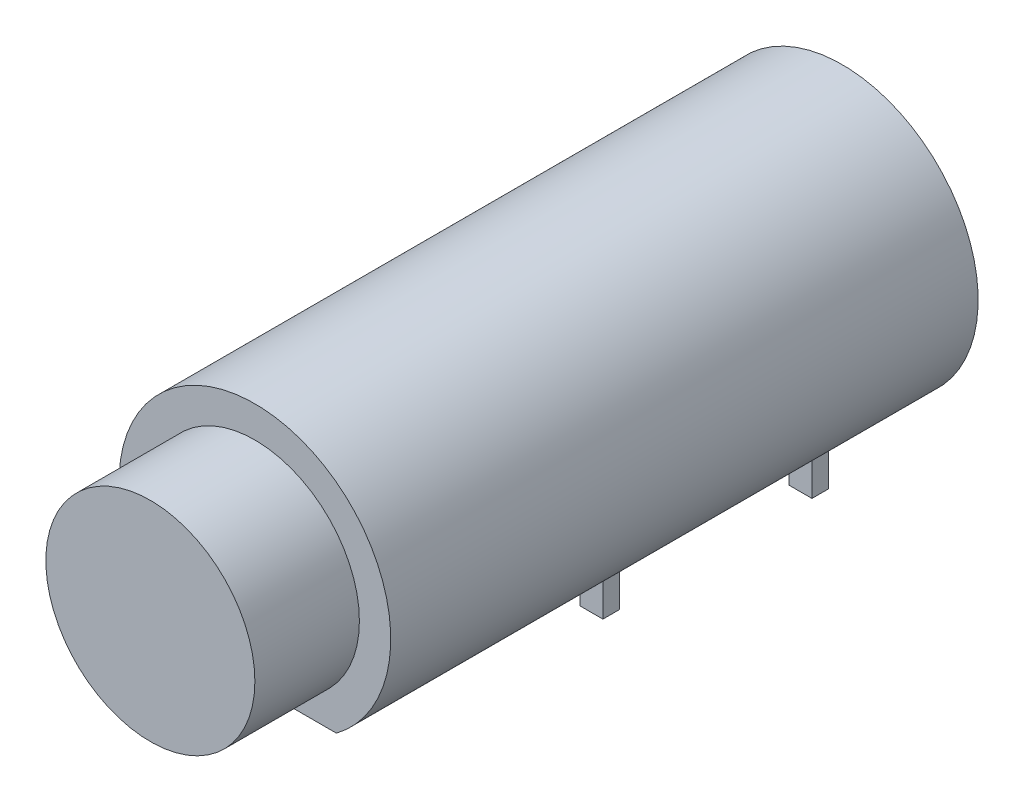
from build123d import *

# Parameters (mm, degrees)
EXTRUDE_1_DEPTH     = 33.1
CUT_EXTRUDE_START   = -5
SKETCH_2_R          = 5
CUT_EXTRUDE_1_DEPTH = 5
SKETCH_3_W          = 1.1
SKETCH_3_H          = 0.8
EXTRUDE_2_DEPTH     = 5


with BuildPart() as part:
    # 草图1 → 凸台-拉伸1 (new body)
    with BuildSketch(Plane.XY):
        with BuildLine():
            Line((-3.9, -5.2), (3.9, -5.2))
            ThreePointArc((3.9, -5.2), (0, 6.5), (-3.9, -5.2))
        make_face()
    extrude(amount=EXTRUDE_1_DEPTH)

    # 草图2 → 切除-拉伸1 (cut)
    with BuildSketch(Plane.XY.offset(33.1).offset(CUT_EXTRUDE_START)):
        with BuildLine():
            Line((-3.9, -5.2), (3.9, -5.2))
            ThreePointArc((3.9, -5.2), (0, 6.5), (-3.9, -5.2))
        make_face()
        Circle(SKETCH_2_R, mode=Mode.SUBTRACT)
    extrude(amount=CUT_EXTRUDE_1_DEPTH, mode=Mode.SUBTRACT)

    # 草图3 → 凸台-拉伸2 (add)
    with BuildSketch(Plane.XZ.offset(5.2)):
        with Locations((0, 11.6)):
            Rectangle(SKETCH_3_W, SKETCH_3_H)
        with Locations((0, 1.6)):
            Rectangle(SKETCH_3_W, SKETCH_3_H)
    extrude(amount=EXTRUDE_2_DEPTH)


solid = part.part
